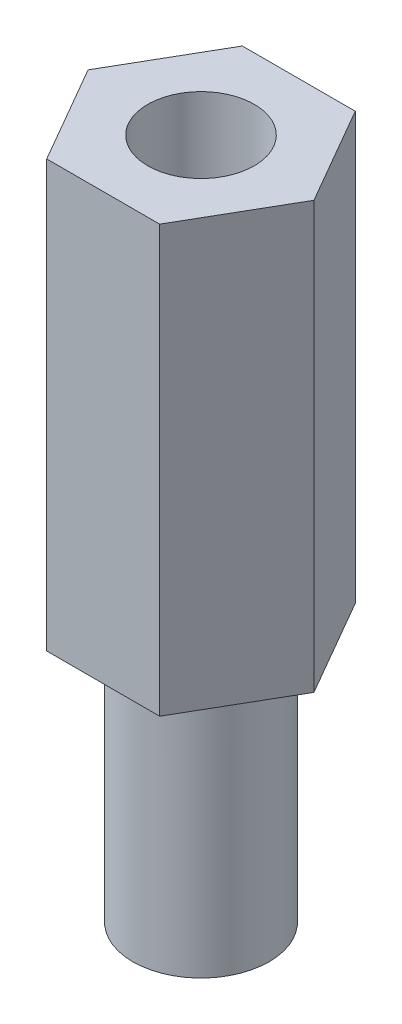
from build123d import *

# Parameters (mm, degrees)
EXTRUDE_1_DEPTH     = 10
SKETCH_6_R          = 1.6
EXTRUDE_2_DEPTH     = 6
SKETCH_7_R          = 1.25
CUT_EXTRUDE_1_DEPTH = 5


with BuildPart() as part:
    # 草图4 → 凸台-拉伸1 (new body)
    with BuildSketch(Plane(origin=(0, 0, 0), x_dir=(1, 0, 0), z_dir=(0, 1, 0))):
        Polygon((1.325, -2.29496732), (2.65, 0), (1.325, 2.29496732), (-1.325, 2.29496732), (-2.65, 0), (-1.325, -2.29496732), align=None)
    extrude(amount=EXTRUDE_1_DEPTH)

    # 草图6 → 凸台-拉伸2 (add)
    with BuildSketch(Plane(origin=(0, 0, 0), x_dir=(-1, 0, 0), z_dir=(0, -1, 0))):
        with Locations(Location((0, 0, 0), (0, 0, 270))):
            Circle(SKETCH_6_R)
    extrude(amount=EXTRUDE_2_DEPTH)

    # 草图7 → 切除-拉伸1 (cut)
    with BuildSketch(Plane(origin=(0, 10, 0), x_dir=(1, 0, 0), z_dir=(0, 1, 0))):
        with Locations(Location((0, 0, 0), (0, 0, 270))):
            Circle(SKETCH_7_R)
    extrude(amount=-CUT_EXTRUDE_1_DEPTH, mode=Mode.SUBTRACT)


solid = part.part
